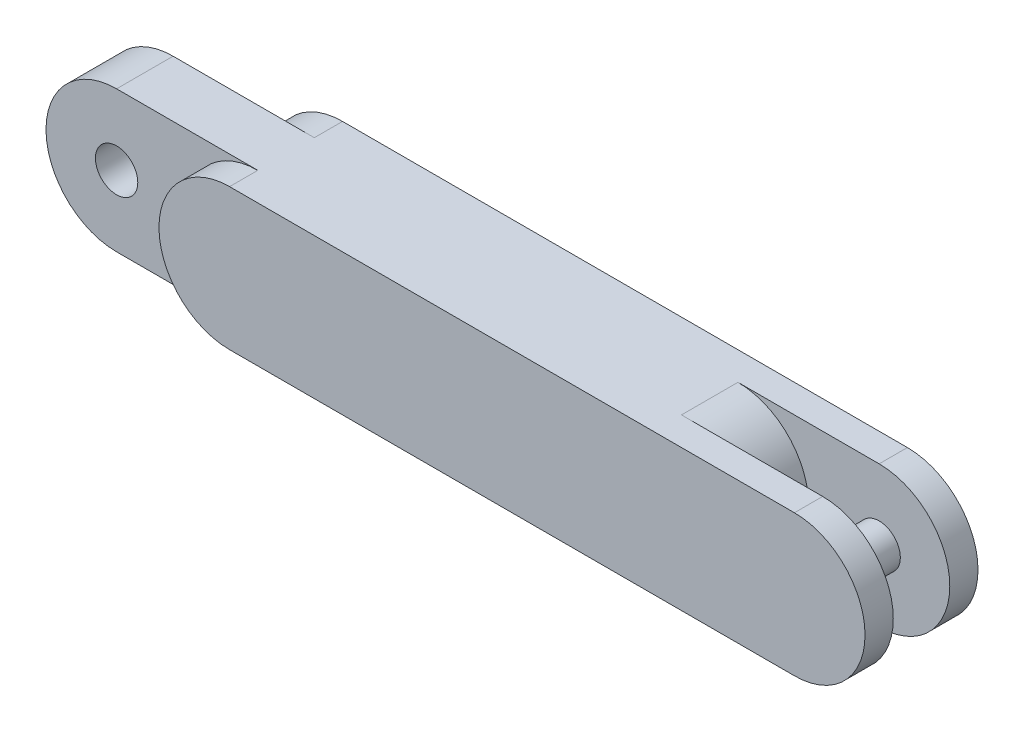
from build123d import *

# Parameters (mm, degrees)
BOSS_EXTRUDE2_DEPTH = 40
CUT_EXTRUDE2_DEPTH  = 20
CUT_EXTRUDE3_START  = -20
CUT_EXTRUDE3_DEPTH  = 20
SKETCH9_R           = 15
CUT_EXTRUDE5_DEPTH  = 40
CUT_EXTRUDE6_DEPTH  = 20
SKETCH11_R          = 15
BOSS_EXTRUDE3_DEPTH = 80


with BuildPart() as part:
    # Sketch4 → Boss-Extrude2 (new, symmetric)
    with BuildSketch(Plane.XY):
        with BuildLine():
            Line((-250, 50), (250, 50))
            ThreePointArc((250, 50), (300, 0), (250, -50))
            Line((250, -50), (-250, -50))
            ThreePointArc((-250, -50), (-300, 0), (-250, 50))
        make_face()
    extrude(amount=BOSS_EXTRUDE2_DEPTH, both=True)

    # Sketch5 → Cut-Extrude2 (cut)
    with BuildSketch(Plane.XY.offset(40)):
        with BuildLine():
            Line((-150, 50), (-250, 50))
            ThreePointArc((-250, 50), (-300, 0), (-250, -50))
            Line((-250, -50), (-150, -50))
            ThreePointArc((-150, -50), (-200, 0), (-150, 50))
        make_face()
    extrude(amount=-CUT_EXTRUDE2_DEPTH, mode=Mode.SUBTRACT)

    # Sketch6 → Cut-Extrude3 (cut)
    with BuildSketch(Plane(origin=(0, 0, -40), x_dir=(-1, 0, 0), z_dir=(0, 0, -1)).offset(CUT_EXTRUDE3_START)):
        with BuildLine():
            Line((150, 50), (250, 50))
            ThreePointArc((250, 50), (300, 0), (250, -50))
            Line((250, -50), (150, -50))
            ThreePointArc((150, -50), (200, 0), (150, 50))
        make_face()
    extrude(amount=CUT_EXTRUDE3_DEPTH, mode=Mode.SUBTRACT)

    # Sketch9 → Cut-Extrude5 (cut)
    with BuildSketch(Plane.XY.offset(20)):
        with Locations((-250, 0)):
            Circle(SKETCH9_R)
    extrude(amount=-CUT_EXTRUDE5_DEPTH, mode=Mode.SUBTRACT)

    # Sketch10 → Cut-Extrude6 (cut, symmetric)
    with BuildSketch(Plane.XY):
        with BuildLine():
            Line((150, 50), (250, 50))
            ThreePointArc((250, 50), (300, 0), (250, -50))
            Line((250, -50), (150, -50))
            ThreePointArc((150, -50), (200, 0), (150, 50))
        make_face()
    extrude(amount=CUT_EXTRUDE6_DEPTH, both=True, mode=Mode.SUBTRACT)

    # Sketch11 → Boss-Extrude3 (add)
    with BuildSketch(Plane.XY.offset(40)):
        with Locations((250, 0)):
            Circle(SKETCH11_R)
    extrude(amount=-BOSS_EXTRUDE3_DEPTH)


solid = part.part
